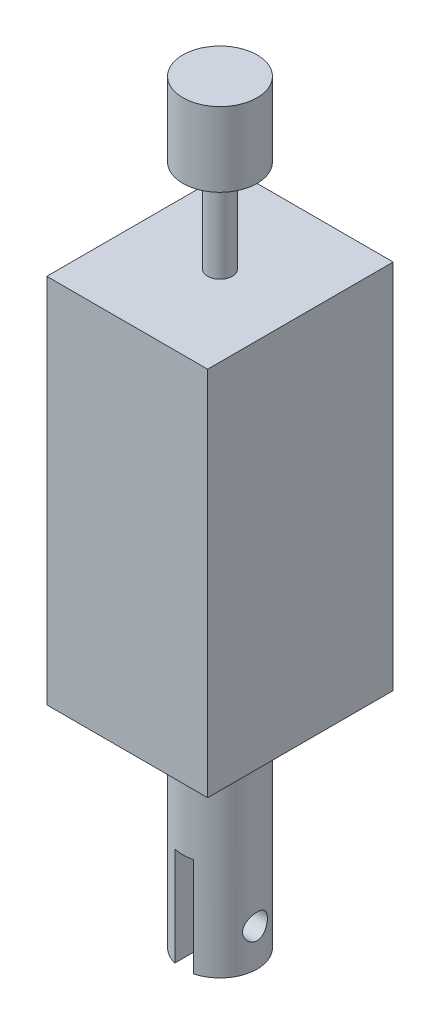
from build123d import *

# Parameters (mm, degrees)
SKETCH1_W           = 13
SKETCH1_H           = 30
BOSS_EXTRUDE1_DEPTH = 15
SKETCH2_R           = 1
BOSS_EXTRUDE2_DEPTH = 7.5
SKETCH3_R           = 3
BOSS_EXTRUDE3_DEPTH = 6
BOSS_EXTRUDE4_START = 17.5
SKETCH4_R           = 3
BOSS_EXTRUDE4_DEPTH = 17.5
SKETCH5_R           = 1
CUT_EXTRUDE1_DEPTH  = 38.033768374
SKETCH6_W           = 1.5
SKETCH6_H           = 8
CUT_EXTRUDE2_DEPTH  = 35.767082226


with BuildPart() as part:
    # Sketch1 → Boss-Extrude1 (new body)
    with BuildSketch(Plane.XY):
        Rectangle(SKETCH1_W, SKETCH1_H)
    extrude(amount=BOSS_EXTRUDE1_DEPTH)

    # Sketch2 → Boss-Extrude2 (add)
    with BuildSketch(Plane(origin=(0, 15, 0), x_dir=(1, 0, 0), z_dir=(0, 1, 0))):
        with Locations((0, -7.5)):
            Circle(SKETCH2_R)
    extrude(amount=BOSS_EXTRUDE2_DEPTH)

    # Sketch3 → Boss-Extrude3 (add)
    with BuildSketch(Plane(origin=(0, 22.5, 0), x_dir=(1, 0, 0), z_dir=(0, 1, 0))):
        with Locations((0, -7.5)):
            Circle(SKETCH3_R)
    extrude(amount=BOSS_EXTRUDE3_DEPTH)

    # Sketch4 → Boss-Extrude4 (add)
    with BuildSketch(Plane.XZ.offset(15).offset(BOSS_EXTRUDE4_START)):
        with Locations((0, 7.5)):
            Circle(SKETCH4_R)
    extrude(amount=-BOSS_EXTRUDE4_DEPTH)

    # Sketch5 → Cut-Extrude1 (cut, through all)
    with BuildSketch(Plane(origin=(3, 0, 0), x_dir=(0, 0, -1), z_dir=(1, 0, 0))):
        with Locations((-7.5, -29.5)):
            Circle(SKETCH5_R)
    extrude(amount=-CUT_EXTRUDE1_DEPTH, mode=Mode.SUBTRACT)

    # Sketch6 → Cut-Extrude2 (cut, through all)
    with BuildSketch(Plane(origin=(0, 0, 4.5), x_dir=(-1, 0, 0), z_dir=(0, 0, -1))):
        with Locations((0, -28.5)):
            Rectangle(SKETCH6_W, SKETCH6_H)
    extrude(amount=-CUT_EXTRUDE2_DEPTH, mode=Mode.SUBTRACT)


solid = part.part
